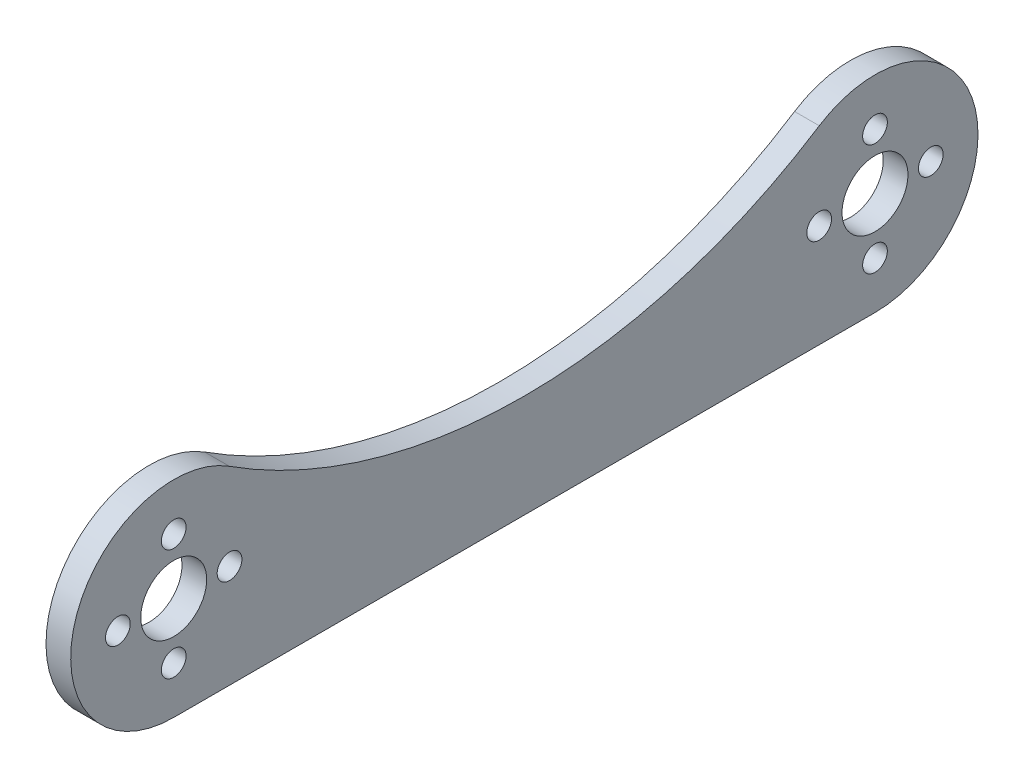
from build123d import *

# Parameters (mm, degrees)
SKETCH1_R           = 4
SKETCH1_R_2         = 1.5
BOSS_EXTRUDE1_DEPTH = 3


with BuildPart() as part:
    # Sketch1 → Boss-Extrude1 (new body)
    with BuildSketch(Plane(origin=(0, 0, 0), x_dir=(0, 0, -1), z_dir=(1, 0, 0))):
        with BuildLine():
            Line((-42.55, -12.5), (42.55, -12.5))
            ThreePointArc((42.55, -12.5), (54.543190221, 3.523263872), (35.789172189, 10.51385787))
            ThreePointArc((35.789172189, 10.51385787), (0, 0), (-35.789172189, 10.51385787))
            ThreePointArc((-35.789172189, 10.51385787), (-54.543190221, 3.523263872), (-42.55, -12.5))
        make_face()
        with Locations((-42.55, 0)):
            Circle(SKETCH1_R, mode=Mode.SUBTRACT)
        with Locations((-35.775, 0)):
            Circle(SKETCH1_R_2, mode=Mode.SUBTRACT)
        with Locations((-42.55, -6.775)):
            Circle(SKETCH1_R_2, mode=Mode.SUBTRACT)
        with Locations((-49.325, 0)):
            Circle(SKETCH1_R_2, mode=Mode.SUBTRACT)
        with Locations((-42.55, 6.775)):
            Circle(SKETCH1_R_2, mode=Mode.SUBTRACT)
        with Locations(Location((42.55, 6.775, 0), (0, 0, 180))):
            Circle(SKETCH1_R_2, mode=Mode.SUBTRACT)
        with Locations(Location((49.325, 0, 0), (0, 0, 180))):
            Circle(SKETCH1_R_2, mode=Mode.SUBTRACT)
        with Locations(Location((42.55, -6.775, 0), (0, 0, 180))):
            Circle(SKETCH1_R_2, mode=Mode.SUBTRACT)
        with Locations(Location((35.775, 0, 0), (0, 0, 180))):
            Circle(SKETCH1_R_2, mode=Mode.SUBTRACT)
        with Locations(Location((42.55, 0, 0), (0, 0, 180))):
            Circle(SKETCH1_R, mode=Mode.SUBTRACT)
    extrude(amount=BOSS_EXTRUDE1_DEPTH)


solid = part.part
